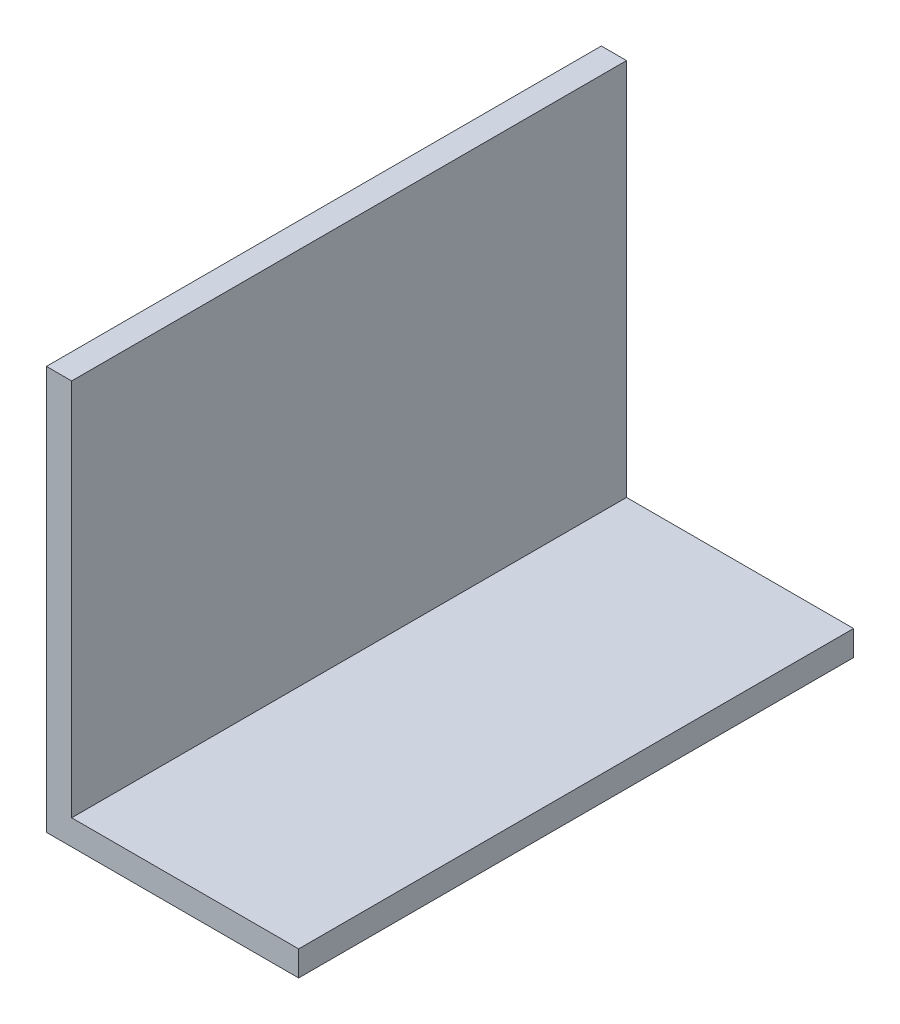
from build123d import *

# Parameters (mm, degrees)
BOSS_EXTRUDE1_DEPTH = 110


with BuildPart() as part:
    # Sketch1 → Boss-Extrude1 (new body)
    with BuildSketch(Plane.XY):
        Polygon((0, 0), (0, -80), (50, -80), (50, -75), (5, -75), (5, 0), align=None)
    extrude(amount=BOSS_EXTRUDE1_DEPTH)


solid = part.part
